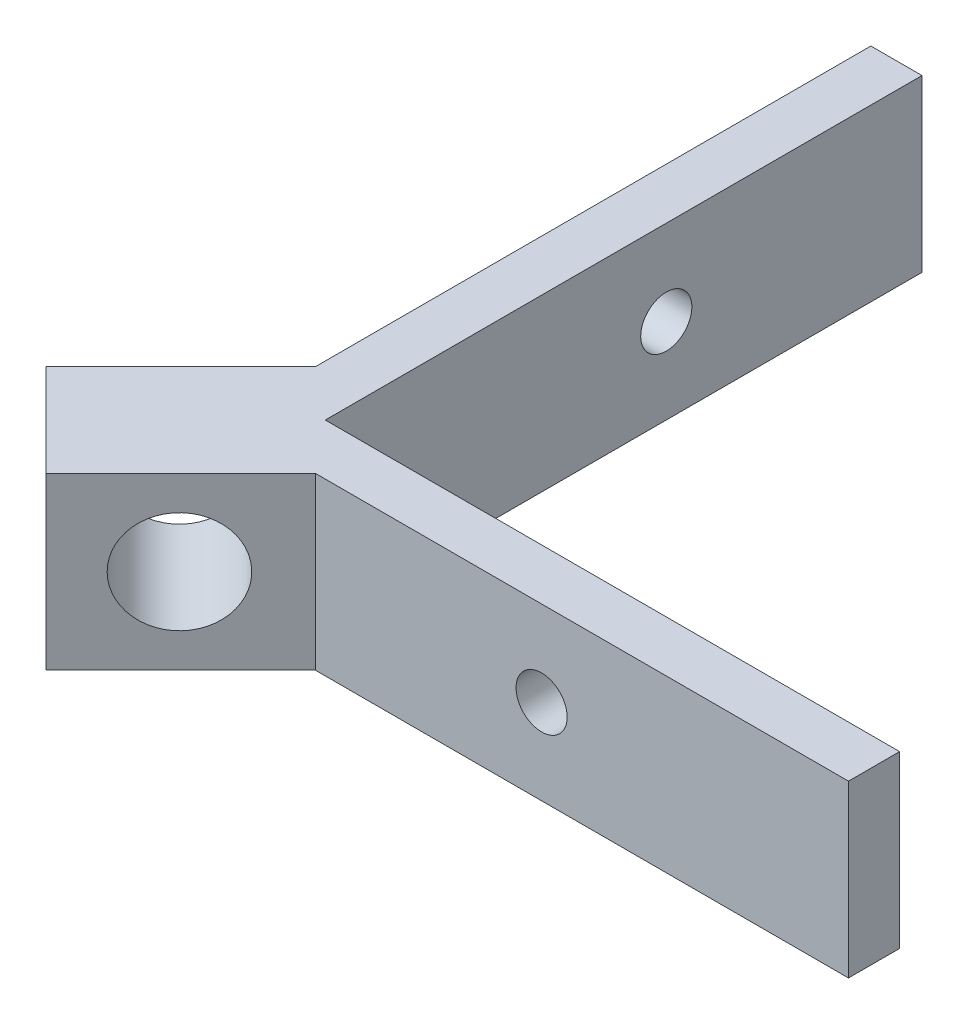
from build123d import *

# Parameters (mm, degrees)
BOSS_EXTRUDE1_DEPTH = 10
SKETCH3_R           = 1.5
CUT_EXTRUDE1_DEPTH  = 30
SKETCH4_R           = 1.5
CUT_EXTRUDE2_DEPTH  = 30
CUT_EXTRUDE5_DEPTH  = 30
SKETCH9_R           = 3
CUT_EXTRUDE6_DEPTH  = 30


with BuildPart() as part:
    # Sketch1 → Boss-Extrude1 (new body)
    with BuildSketch(Plane(origin=(0, 0, 0), x_dir=(1, 0, 0), z_dir=(0, 1, 0))):
        Polygon((1.311744675, 2.415195475), (1.311744675, 35), (4.311744675, 35), (4.311744675, 0), (38, 0), (38, -3), (6.726940148, -3), (6.726940148, -11.726940148), (3.191406243, -15.262474054), (-10.950729381, -1.120338431), (-7.415195475, 2.415195475), align=None)
    extrude(amount=BOSS_EXTRUDE1_DEPTH)

    # Sketch3 → Cut-Extrude1 (cut)
    with BuildSketch(Plane.XY.offset(3)):
        with Locations((20, 5)):
            Circle(SKETCH3_R)
    extrude(amount=-CUT_EXTRUDE1_DEPTH, mode=Mode.SUBTRACT)

    # Sketch4 → Cut-Extrude2 (cut)
    with BuildSketch(Plane.ZY.offset(-1.311744675)):
        with Locations((-20, 5)):
            Circle(SKETCH4_R)
    extrude(amount=-CUT_EXTRUDE2_DEPTH, mode=Mode.SUBTRACT)

    # Sketch8 → Cut-Extrude5 (cut)
    with BuildSketch(Plane(origin=(0, 10, 0), x_dir=(1, 0, 0), z_dir=(0, 1, 0))):
        Polygon((1.311744675, 2.415195475), (-7.06515363, -5.961702829), (-14.174938383, 1.148081923), (-5.798040078, 9.524980228), align=None)
        Polygon((6.726940148, -3), (-1.172063832, -10.89900398), (4.537107227, -16.608175039), (12.436111207, -8.709171058), align=None)
    extrude(amount=-CUT_EXTRUDE5_DEPTH, mode=Mode.SUBTRACT)

    # Sketch9 → Cut-Extrude6 (cut)
    with BuildSketch(Plane(origin=(-0.5517254, 0, -0.5517254), x_dir=(-0.7071067811865474, 0, 0.7071067811865477), z_dir=(-0.7071067811865477, 0, -0.7071067811865474))):
        with Locations((3, 5)):
            Circle(SKETCH9_R)
    extrude(amount=-CUT_EXTRUDE6_DEPTH, mode=Mode.SUBTRACT)


solid = part.part
